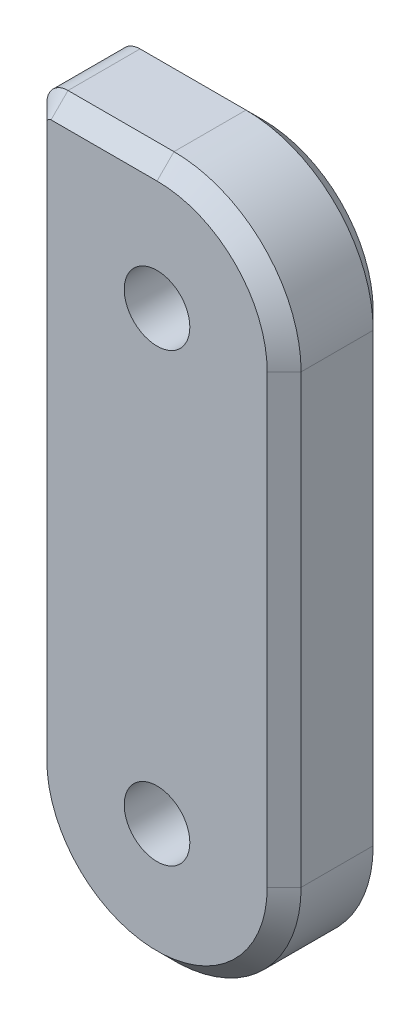
from build123d import *

# Parameters (mm, degrees)
BOSS_EXTRUDE1_DEPTH   = 7.9375
F_8_CLEARANCE_HOLE1_D = 4.9149
F_8_CLEARANCE_HOLE2_D = 4.9149
SKETCH7_R             = 5.08
CUT_EXTRUDE1_DEPTH    = 2.032
FILLET1_R             = 1.5875
CHAMFER2_SIZE         = 1.27


with BuildPart() as part:
    # Sketch2 → Boss-Extrude1 (new body)
    with BuildSketch(Plane.XY):
        with BuildLine():
            Line((-9.525, 42.96918), (-9.525, 0))
            ThreePointArc((-9.525, 0), (0, -9.525), (9.525, 0))
            Line((9.525, 0), (9.525, 33.44418))
            ThreePointArc((9.525, 33.44418), (6.735192091, 40.179372091), (0, 42.96918))
            Line((0, 42.96918), (-9.525, 42.96918))
        make_face()
    extrude(amount=BOSS_EXTRUDE1_DEPTH)

    # #8 Clearance Hole1 (through all)
    with Locations(Plane.XY.offset(7.9375)):
        with Locations((0, 0)):
            Hole(F_8_CLEARANCE_HOLE1_D / 2)

    # #8 Clearance Hole2 (through all)
    with Locations(Plane.XY.offset(7.9375)):
        with Locations((0, 33.44418)):
            Hole(F_8_CLEARANCE_HOLE2_D / 2)

    # Sketch7 → Cut-Extrude1 (cut)
    with BuildSketch(Plane(origin=(0, 0, 0), x_dir=(-1, 0, 0), z_dir=(0, 0, -1))):
        with Locations((0, 33.44418)):
            Circle(SKETCH7_R)
    extrude(amount=-CUT_EXTRUDE1_DEPTH, mode=Mode.SUBTRACT)

    # Fillet1
    fillet1_edges = [part.edges().sort_by_distance(p)[0] for p in [
        (-9.525, 42.96918, 3.96875),
    ]]
    fillet(fillet1_edges, radius=FILLET1_R)

    # Chamfer2
    chamfer2_edges = [part.edges().sort_by_distance(p)[0] for p in [
        (6.735192091, 40.179372091, 7.9375),
        (-3.96875, 42.96918, 7.9375),
        (-9.525, 20.69084, 0),
        (-9.525, 20.69084, 7.9375),
        (-9.060032015, 42.504212015, 0),
        (-9.060032015, 42.504212015, 7.9375),
        (0, -9.525, 7.9375),
        (-3.96875, 42.96918, 0),
        (6.735192091, 40.179372091, 0),
        (9.525, 16.72209, 0),
        (0, -9.525, 0),
        (9.525, 16.72209, 7.9375),
    ]]
    chamfer(chamfer2_edges, length=CHAMFER2_SIZE)


solid = part.part
